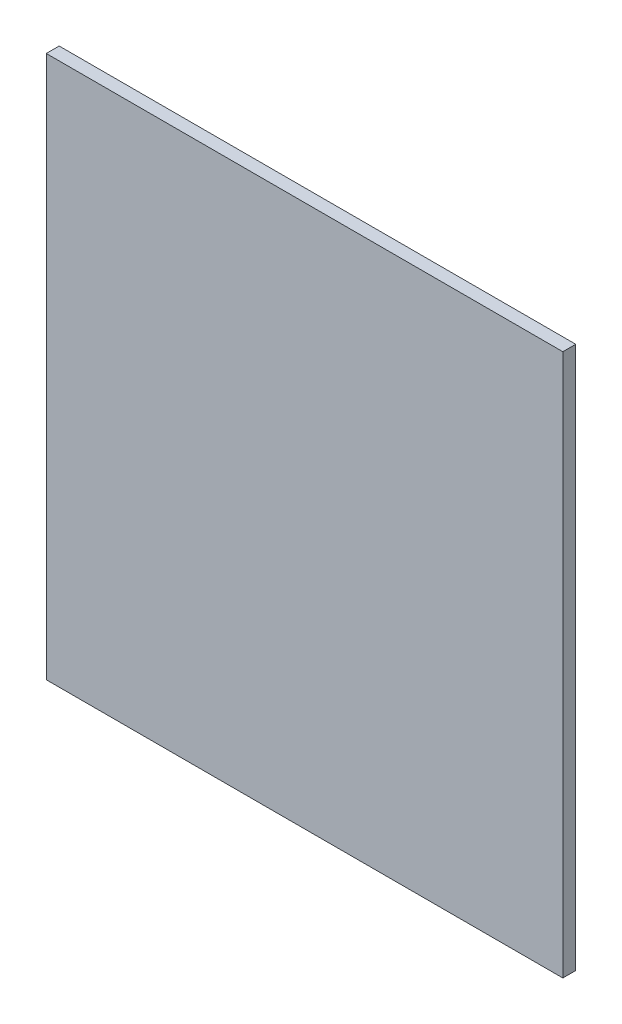
from build123d import *

# Parameters (mm, degrees)
SKETCH1_W           = 190.475
SKETCH1_H           = 200
BOSS_EXTRUDE1_DEPTH = 4.7625


with BuildPart() as part:
    # Sketch1 → Boss-Extrude1 (new body)
    with BuildSketch(Plane.XY):
        with Locations((95.2375, 104.7625)):
            Rectangle(SKETCH1_W, SKETCH1_H)
    extrude(amount=-BOSS_EXTRUDE1_DEPTH)


solid = part.part
